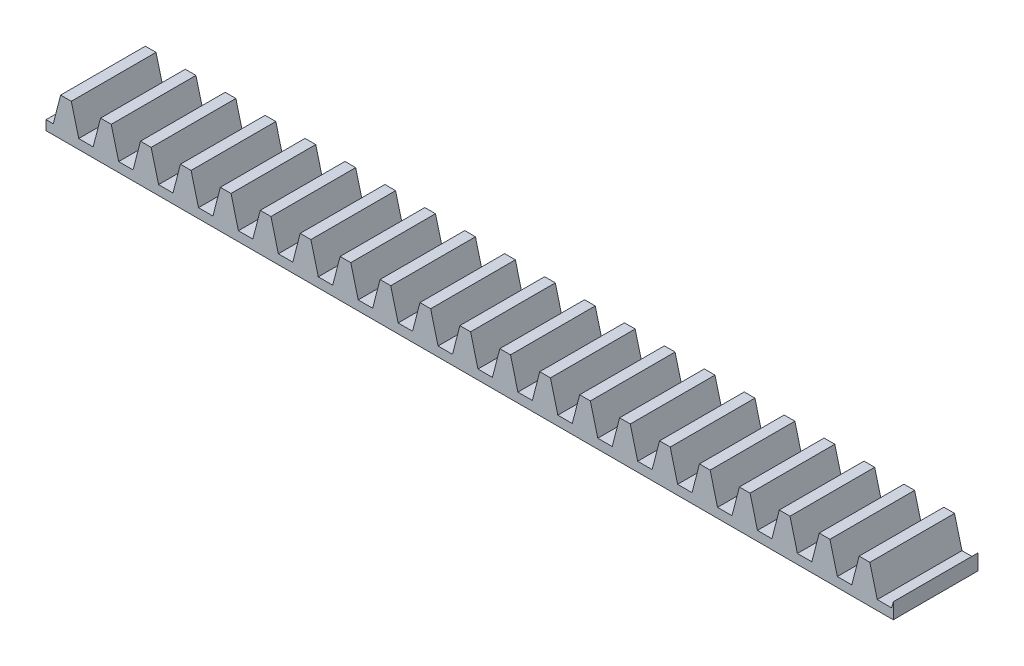
from build123d import *

# Parameters (mm, degrees)
BLANKSKE_W        = 100
BLANKSKE_H        = 4.5
BLANK_DEPTH       = 10
TOOTHCUTSIM_DEPTH = 101.599453279
TEETHCUTS_COUNT   = 22
TEETHCUTS_PITCH   = 4.712388975


with BuildPart() as part:
    # BlankSke → Blank (new body)
    with BuildSketch(Plane.XY):
        with Locations((50, 2.25)):
            Rectangle(BLANKSKE_W, BLANKSKE_H)
    extrude(amount=-BLANK_DEPTH)

    # TooCutSkeSim → ToothCutSim (cut, through all)
    with BuildSketch(Plane.XY):
        Polygon((0.852189273, 1.125), (-0.852189273, 1.125), (-1.731592507, 4.5254), (1.731592507, 4.5254), align=None)
    toothcutsim = extrude(amount=-TOOTHCUTSIM_DEPTH, mode=Mode.SUBTRACT)

    # TeethCuts: ToothCutSim ×22
    with Locations(*[(i * TEETHCUTS_PITCH, 0, 0) for i in range(1, TEETHCUTS_COUNT)]):
        add(toothcutsim, mode=Mode.SUBTRACT)


solid = part.part
